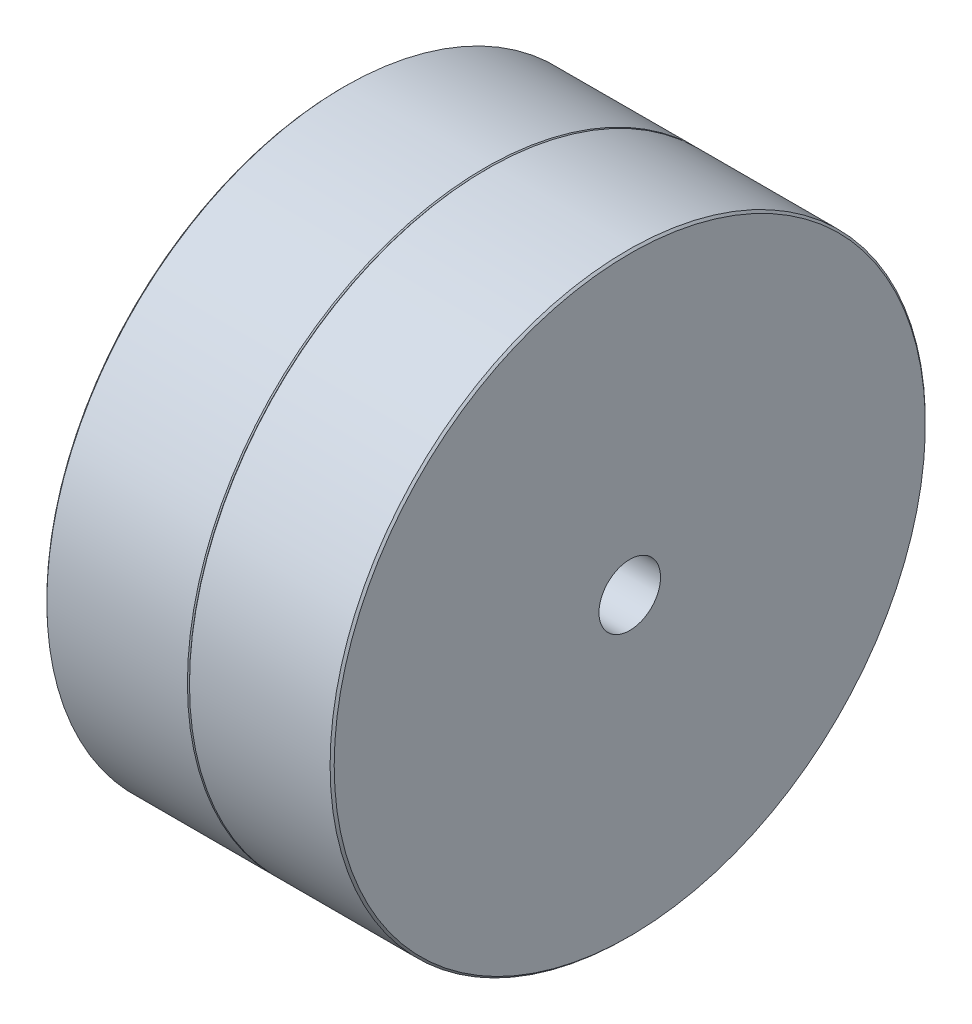
from build123d import *

# Parameters (mm, degrees)
CHAMFER_1_SIZE = 0.2


with BuildPart() as part:
    # 草图1 → 旋转1 (revolve)
    with BuildSketch(Plane.XY, mode=Mode.PRIVATE) as revolve_1_sk:
        Polygon((0, 3), (0, 29), (13.9, 29), (14, 28.9), (14.1, 29), (28, 29), (28, 13), (28, 10), (28, 3), align=None)
    revolve(revolve_1_sk.sketch.rotate(Axis((0, 0, 0), (1, 0, 0)), 90), axis=Axis((0, 0, 0), (1, 0, 0)))

    # 倒角1
    chamfer_1_edges = [part.edges().sort_by_distance(p)[0] for p in [
        (0, 0, -3),
        (28, 0, -29),
        (0, 0, -29),
    ]]
    chamfer(chamfer_1_edges, length=CHAMFER_1_SIZE)


solid = part.part
